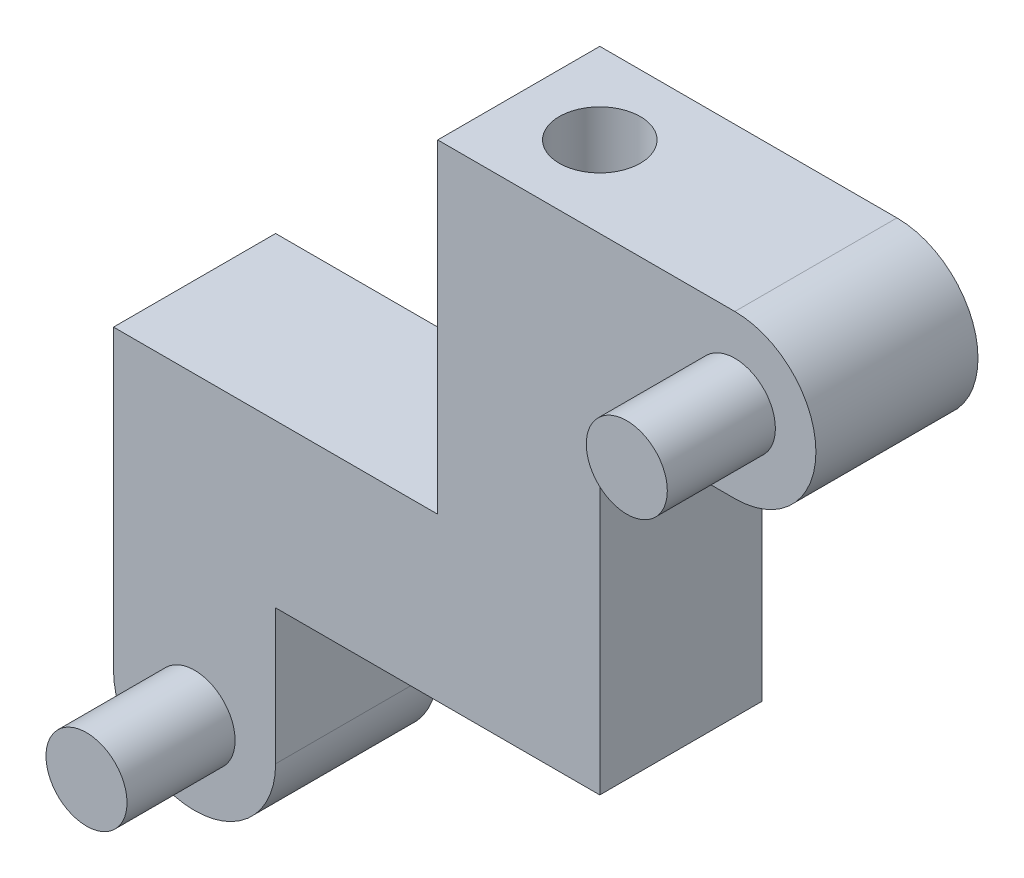
from build123d import *

# Parameters (mm, degrees)
BOSS_EXTRUDE1_DEPTH = 30
SKETCH2_R           = 7.5
BOSS_EXTRUDE2_DEPTH = 20
SKETCH3_R           = 7.5
CUT_EXTRUDE1_DEPTH  = 20


with BuildPart() as part:
    # Sketch1 → Boss-Extrude1 (new body)
    with BuildSketch(Plane.XY):
        with BuildLine():
            Line((0, 0), (0, 60))
            Line((0, 60), (55, 60))
            ThreePointArc((55, 60), (70, 45), (55, 30))
            Line((55, 30), (30, 30))
            Line((30, 30), (30, -30))
            Line((30, -30), (0, 0))
        make_face()
    boss_extrude1 = extrude(amount=BOSS_EXTRUDE1_DEPTH)

    # Sketch2 → Boss-Extrude2 (add)
    with BuildSketch(Plane.XY.offset(30)):
        with Locations((55, 45)):
            Circle(SKETCH2_R)
    boss_extrude2 = extrude(amount=BOSS_EXTRUDE2_DEPTH)

    # Sketch3 → Cut-Extrude1 (cut)
    with BuildSketch(Plane(origin=(0, 60, 0), x_dir=(1, 0, 0), z_dir=(0, 1, 0))):
        with Locations(Location((15, -15, 0), (0, 0, 270))):
            Circle(SKETCH3_R)
    cut_extrude1 = extrude(amount=-CUT_EXTRUDE1_DEPTH, mode=Mode.SUBTRACT)

    # Mirror1: Boss-Extrude1, Boss-Extrude2, Cut-Extrude1 across plane
    add(boss_extrude1.mirror(Plane(origin=(30, -30, 30), x_dir=(0, 0, 1), z_dir=(0.7071067811865512, 0.7071067811865439, 0))))
    add(boss_extrude2.mirror(Plane(origin=(30, -30, 30), x_dir=(0, 0, 1), z_dir=(0.7071067811865512, 0.7071067811865439, 0))))
    add(cut_extrude1.mirror(Plane(origin=(30, -30, 30), x_dir=(0, 0, 1), z_dir=(0.7071067811865512, 0.7071067811865439, 0))), mode=Mode.SUBTRACT)


solid = part.part
